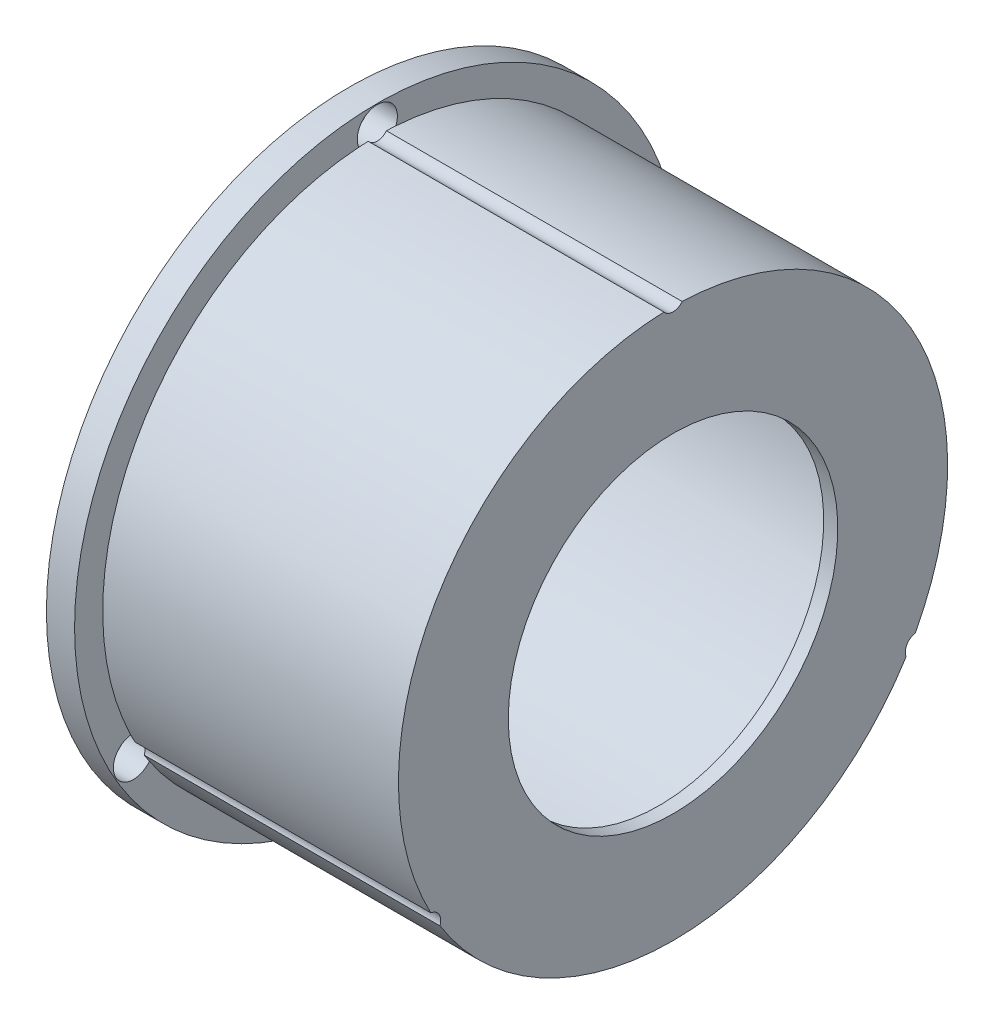
from build123d import *

# Parameters (mm, degrees)
AXIAL_HOLES_DEPTH      = 192.606080279
AXIAL_HOLES_DEPTH_BACK = 192.606080279
SKETCH2_R              = 1.65
CUT_EXTRUDE2_START     = 135.7
SKETCH3_R              = 2.85
CUT_EXTRUDE2_DEPTH     = 4


with BuildPart() as part:
    # Axial profile (mm) → Full revolution (revolve)
    with BuildSketch(Plane.XY, mode=Mode.PRIVATE) as full_revolution_sk:
        Polygon((135.7, 36.4), (179.7, 36.4), (179.7, 23.4), (181.7, 23.4), (181.7, 39), (139.7, 39), (139.7, 43), (135.7, 43), align=None)
    revolve(full_revolution_sk.sketch.rotate(Axis((-110, 0, 0), (1, 0, 0)), 90), axis=Axis((-110, 0, 0), (1, 0, 0)))

    # Sketch2 → Axial holes (cut, two sides: drawn at the far end of the back side and taken through both)
    with BuildSketch(Plane(origin=(0, 0, 0), x_dir=(0, 0, -1), z_dir=(1, 0, 0)).offset(-AXIAL_HOLES_DEPTH_BACK)):
        with Locations(Location((0, 40, 0), (0, 0, 218.251159994))):
            Circle(SKETCH2_R)
        with Locations(Location((-34.641016151, -20, 0), (0, 0, 81.748840006))):
            Circle(SKETCH2_R)
        with Locations(Location((34.641016151, -20, 0), (0, 0, 201.748840006))):
            Circle(SKETCH2_R)
    extrude(amount=AXIAL_HOLES_DEPTH + AXIAL_HOLES_DEPTH_BACK, mode=Mode.SUBTRACT)

    # Sketch3 → Cut-Extrude2 (cut)
    with BuildSketch(Plane(origin=(0, 0, 0), x_dir=(0, 0, -1), z_dir=(1, 0, 0)).offset(CUT_EXTRUDE2_START)):
        with Locations(Location((0, 40, 0), (0, 0, 202.464828441))):
            Circle(SKETCH3_R)
        with Locations(Location((-34.641016151, -20, 0), (0, 0, 97.535171559))):
            Circle(SKETCH3_R)
        with Locations(Location((34.641016151, -20, 0), (0, 0, 217.535171559))):
            Circle(SKETCH3_R)
    extrude(amount=CUT_EXTRUDE2_DEPTH, mode=Mode.SUBTRACT)


solid = part.part
